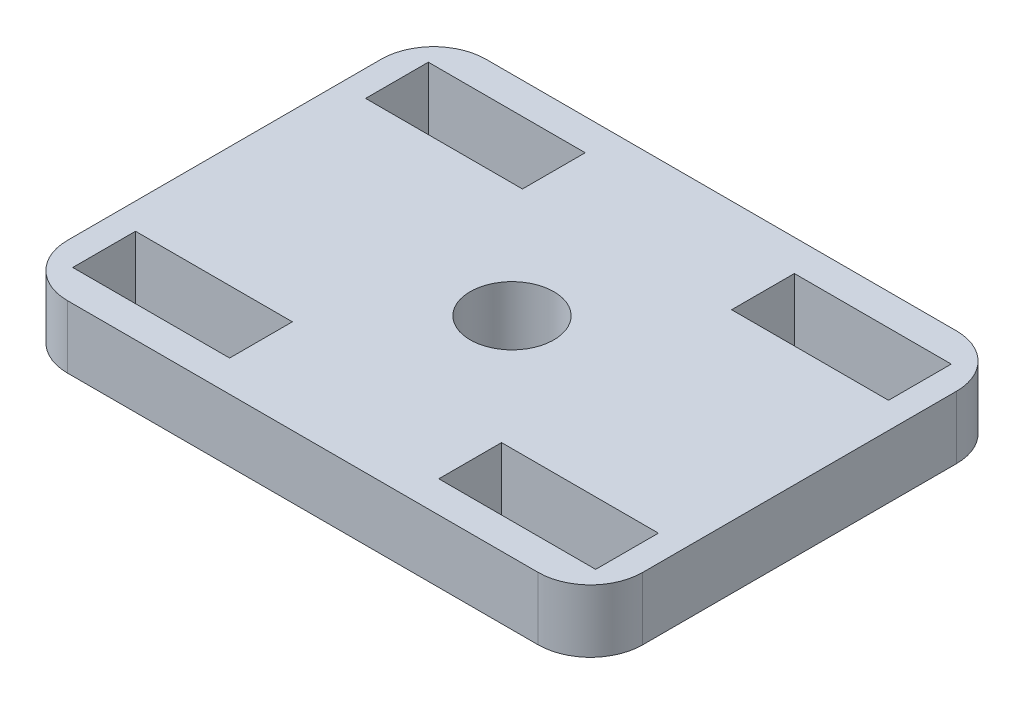
from build123d import *

# Parameters (mm, degrees)
CROQUIS1_W              = 55
CROQUIS1_H              = 40
SALIENTE_EXTRUIR1_DEPTH = 3
CROQUIS2_W              = 15
CROQUIS2_H              = 6
CORTAR_EXTRUIR1_DEPTH   = 35.528973341
CROQUIS3_R              = 4
CORTAR_EXTRUIR2_DEPTH   = 35.528973341
REDONDEO1_R             = 5


with BuildPart() as part:
    # Croquis1 → Saliente-Extruir1 (new, symmetric)
    with BuildSketch(Plane(origin=(0, 0, 0), x_dir=(1, 0, 0), z_dir=(0, 1, 0))):
        Rectangle(CROQUIS1_W, CROQUIS1_H)
    extrude(amount=SALIENTE_EXTRUIR1_DEPTH, both=True)

    # Croquis2 → Cortar-Extruir1 (cut, through all)
    with BuildSketch(Plane(origin=(0, -3, 0), x_dir=(-1, 0, 0), z_dir=(0, -1, 0))):
        with Locations((17.5, -14)):
            Rectangle(CROQUIS2_W, CROQUIS2_H)
        with Locations((-17.5, -14)):
            Rectangle(CROQUIS2_W, CROQUIS2_H)
        with Locations((17.5, 14)):
            Rectangle(CROQUIS2_W, CROQUIS2_H)
        with Locations((-17.5, 14)):
            Rectangle(CROQUIS2_W, CROQUIS2_H)
    extrude(amount=-CORTAR_EXTRUIR1_DEPTH, mode=Mode.SUBTRACT)

    # Croquis3 → Cortar-Extruir2 (cut, through all)
    with BuildSketch(Plane(origin=(0, -3, 0), x_dir=(-1, 0, 0), z_dir=(0, -1, 0))):
        with Locations(Location((0, 0, 0), (0, 0, 90))):
            Circle(CROQUIS3_R)
    extrude(amount=-CORTAR_EXTRUIR2_DEPTH, mode=Mode.SUBTRACT)

    # Redondeo1
    redondeo1_edges = [part.edges().sort_by_distance(p)[0] for p in [
        (27.5, 0, 20),
        (-27.5, 0, 20),
        (-27.5, 0, -20),
        (27.5, 0, -20),
    ]]
    fillet(redondeo1_edges, radius=REDONDEO1_R)


solid = part.part
